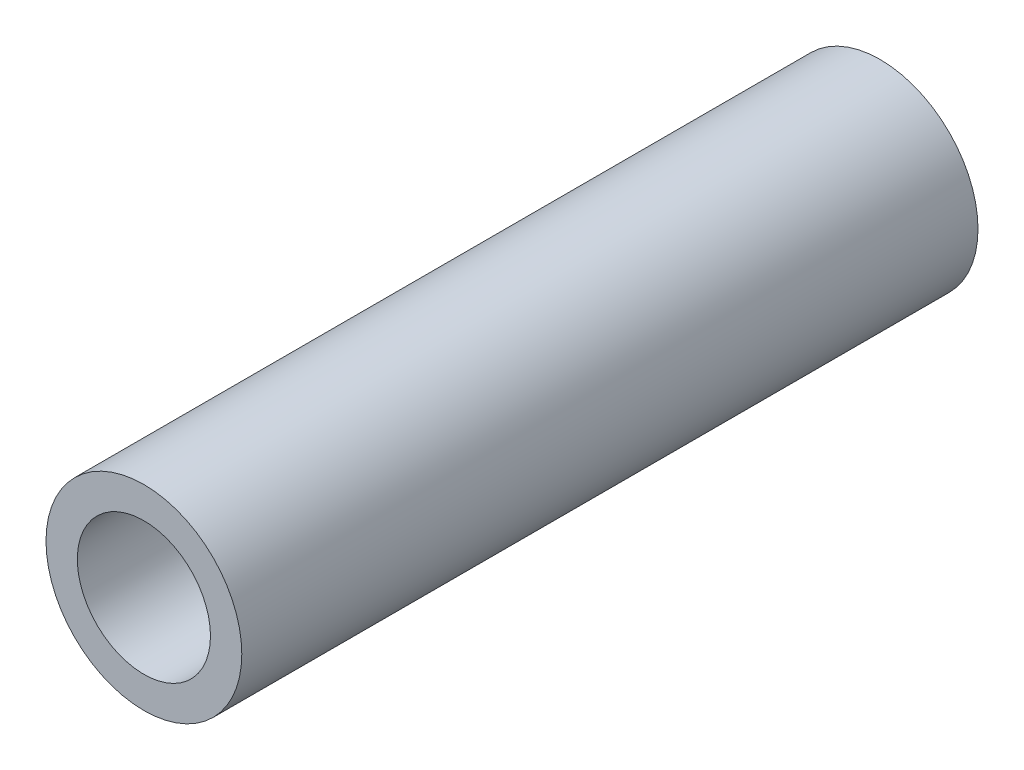
from build123d import *

# Parameters (mm, degrees)
SKETCH1_R               = 2.5
BOSS_EXTRUDE1_DEPTH     = 18.8
CUT_EXTRUDE1_DEPTH      = 20.12955828
CUT_EXTRUDE1_DEPTH_BACK = 20.12955828
SKETCH2_R               = 1.7


with BuildPart() as part:
    # Sketch1 → Boss-Extrude1 (new body)
    with BuildSketch(Plane(origin=(0, 0, 0), x_dir=(0, 1, 0), z_dir=(0, 0, 1))):
        with Locations(Location((0, 0, 0), (0, 0, 270))):
            Circle(SKETCH1_R)
    extrude(amount=BOSS_EXTRUDE1_DEPTH)

    # Sketch2 → Cut-Extrude1 (cut, two sides: drawn at the far end of the back side and taken through both)
    with BuildSketch(Plane.XY.offset(18.8).offset(-CUT_EXTRUDE1_DEPTH_BACK)):
        Circle(SKETCH2_R)
    extrude(amount=CUT_EXTRUDE1_DEPTH + CUT_EXTRUDE1_DEPTH_BACK, mode=Mode.SUBTRACT)


solid = part.part
